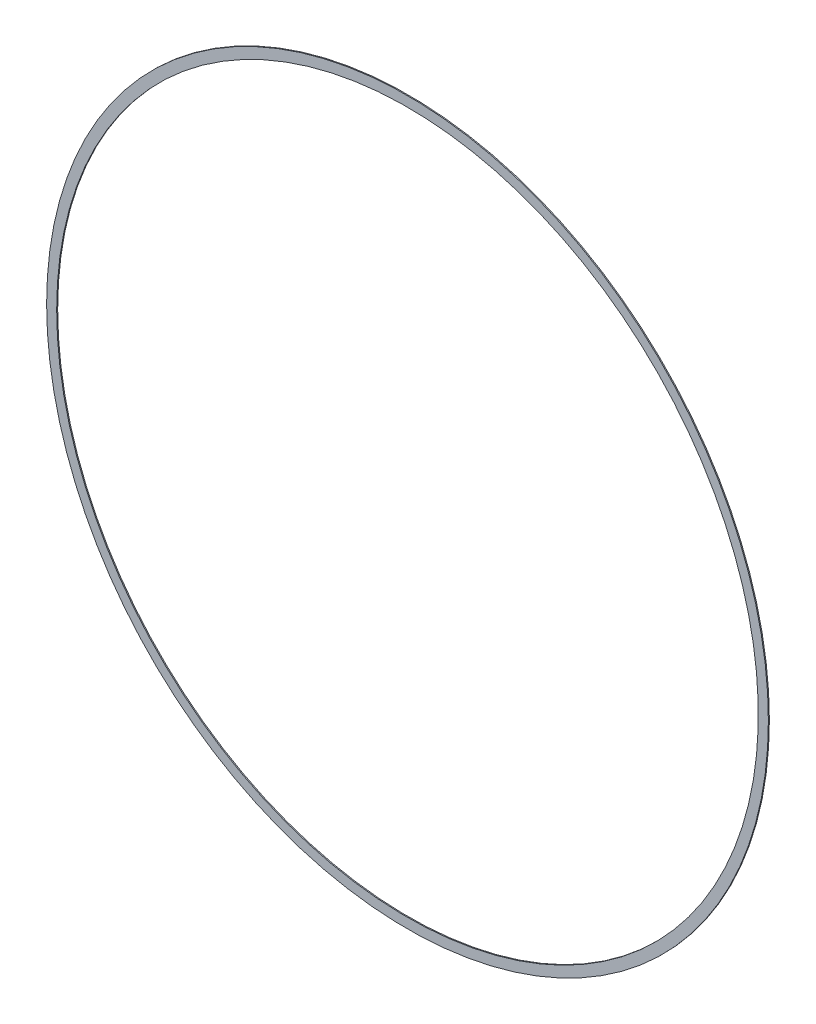
from build123d import *

# Parameters (mm, degrees)
SKETCH1_R           = 1077
SKETCH1_R_2         = 1047
EXTRUDE_THIN1_DEPTH = 3


with BuildPart() as part:
    # Sketch1 → Extrude-Thin1 (new body)
    with BuildSketch(Plane.XY):
        Circle(SKETCH1_R)
        Circle(SKETCH1_R_2, mode=Mode.SUBTRACT)
    extrude(amount=EXTRUDE_THIN1_DEPTH)


solid = part.part
